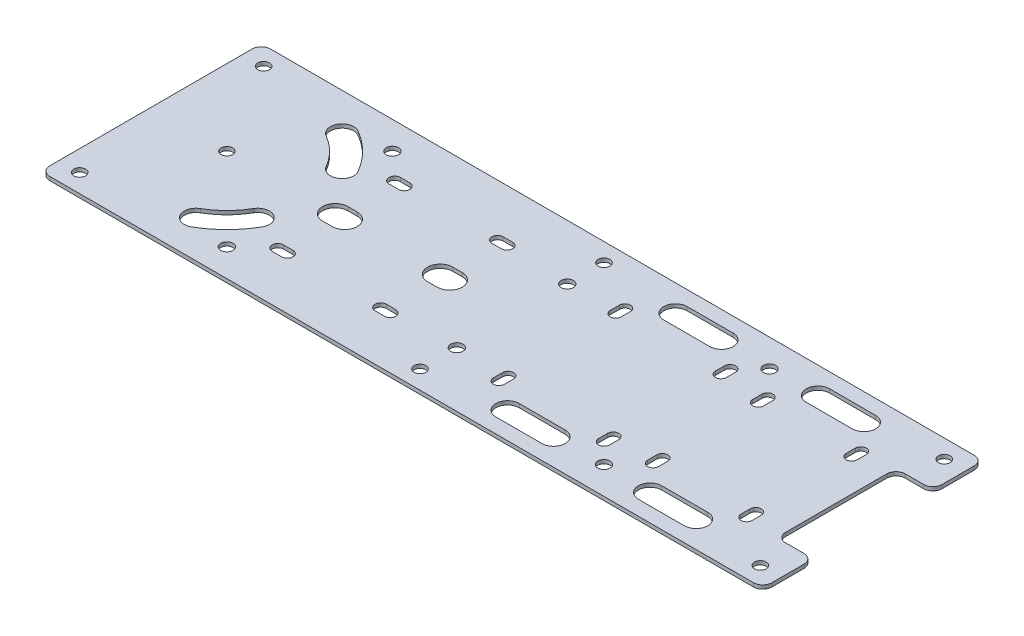
from build123d import *

# Parameters (mm, degrees)
SKETCH1_W               = 392.54
SKETCH1_H               = 120
SKETCH1_R               = 3.2
BOSS_EXTRUDE1_DEPTH     = 2.03
CUT_EXTRUDE3_DEPTH      = 206.246275971
CUT_EXTRUDE3_DEPTH_BACK = 206.246275971
SKETCH3_R               = 3.15
CUT_EXTRUDE4_DEPTH      = 206.246275971
FILLET1_R               = 5
SKETCH4_R               = 3.35
CUT_EXTRUDE5_DEPTH      = 206.246275971


with BuildPart() as part:
    # Sketch1 → Boss-Extrude1 (new body)
    with BuildSketch(Plane(origin=(0, 0, 0), x_dir=(1, 0, 0), z_dir=(0, 1, 0))):
        Rectangle(SKETCH1_W, SKETCH1_H)
        with Locations(Location((0, -50, 0), (0, 0, 270))):
            Circle(SKETCH1_R, mode=Mode.SUBTRACT)
        with Locations(Location((185, -50, 0), (0, 0, 270))):
            Circle(SKETCH1_R, mode=Mode.SUBTRACT)
        with Locations(Location((185, 50, 0), (0, 0, 270))):
            Circle(SKETCH1_R, mode=Mode.SUBTRACT)
        with Locations(Location((0, 50, 0), (0, 0, 270))):
            Circle(SKETCH1_R, mode=Mode.SUBTRACT)
        with Locations(Location((-185, 50, 0), (0, 0, 270))):
            Circle(SKETCH1_R, mode=Mode.SUBTRACT)
        with Locations(Location((-185, -50, 0), (0, 0, 270))):
            Circle(SKETCH1_R, mode=Mode.SUBTRACT)
    extrude(amount=BOSS_EXTRUDE1_DEPTH)

    # Sketch2 → Cut-Extrude3 (cut, two sides: drawn at the far end of the back side and taken through both)
    with BuildSketch(Plane(origin=(0, 0, 0), x_dir=(1, 0, 0), z_dir=(0, 1, 0)).offset(-CUT_EXTRUDE3_DEPTH_BACK)):
        with BuildLine():
            Line((181.27, -32.5), (196.27, -32.5))
            Line((196.27, -32.5), (196.27, 32.5))
            Line((196.27, 32.5), (181.27, 32.5))
            ThreePointArc((181.27, 32.5), (177.734466094, 31.035533906), (176.27, 27.5))
            Line((176.27, 27.5), (176.27, -27.5))
            ThreePointArc((176.27, -27.5), (177.734466094, -31.035533906), (181.27, -32.5))
        make_face()
    extrude(amount=CUT_EXTRUDE3_DEPTH + CUT_EXTRUDE3_DEPTH_BACK, mode=Mode.SUBTRACT)

    # Sketch3 → Cut-Extrude4 (cut, through all)
    with BuildSketch(Plane(origin=(0, 0, 0), x_dir=(1, 0, 0), z_dir=(0, 1, 0))):
        with Locations(Location((-155, 0, 0), (0, 0, 270))):
            Circle(SKETCH3_R)
        with BuildLine():
            Line((-90.375, 34.83), (-95.535, 34.83))
            ThreePointArc((-95.535, 34.83), (-98.615, 31.75), (-95.535, 28.67))
            Line((-95.535, 28.67), (-90.375, 28.67))
            ThreePointArc((-90.375, 28.67), (-87.295, 31.75), (-90.375, 34.83))
        make_face()
        with BuildLine():
            Line((-39.625, 28.67), (-34.465, 28.67))
            ThreePointArc((-34.465, 28.67), (-31.385, 31.75), (-34.465, 34.83))
            Line((-34.465, 34.83), (-39.625, 34.83))
            ThreePointArc((-39.625, 34.83), (-42.705, 31.75), (-39.625, 28.67))
        make_face()
        with BuildLine():
            Line((-95.535, -34.83), (-90.375, -34.83))
            ThreePointArc((-90.375, -34.83), (-87.295, -31.75), (-90.375, -28.67))
            Line((-90.375, -28.67), (-95.535, -28.67))
            ThreePointArc((-95.535, -28.67), (-98.615, -31.75), (-95.535, -34.83))
        make_face()
        with BuildLine():
            Line((-39.625, -34.83), (-34.465, -34.83))
            ThreePointArc((-34.465, -34.83), (-31.385, -31.75), (-34.465, -28.67))
            Line((-34.465, -28.67), (-39.625, -28.67))
            ThreePointArc((-39.625, -28.67), (-42.705, -31.75), (-39.625, -34.83))
        make_face()
        with BuildLine():
            Line((24.14375, 29.25), (24.14375, 34.25))
            ThreePointArc((24.14375, 34.25), (27.14375, 37.25), (30.14375, 34.25))
            Line((30.14375, 34.25), (30.14375, 29.25))
            ThreePointArc((30.14375, 29.25), (27.14375, 26.25), (24.14375, 29.25))
        make_face()
        with BuildLine():
            Line((81.29375, 29.25), (81.29375, 34.25))
            ThreePointArc((81.29375, 34.25), (84.29375, 37.25), (87.29375, 34.25))
            Line((87.29375, 34.25), (87.29375, 29.25))
            ThreePointArc((87.29375, 29.25), (84.29375, 26.25), (81.29375, 29.25))
        make_face()
        with BuildLine():
            Line((24.14375, -34.25), (24.14375, -29.25))
            ThreePointArc((24.14375, -29.25), (27.14375, -26.25), (30.14375, -29.25))
            Line((30.14375, -29.25), (30.14375, -34.25))
            ThreePointArc((30.14375, -34.25), (27.14375, -37.25), (24.14375, -34.25))
        make_face()
        with BuildLine():
            Line((81.29375, -34.25), (81.29375, -29.25))
            ThreePointArc((81.29375, -29.25), (84.29375, -26.25), (87.29375, -29.25))
            Line((87.29375, -29.25), (87.29375, -34.25))
            ThreePointArc((87.29375, -34.25), (84.29375, -37.25), (81.29375, -34.25))
        make_face()
        with BuildLine():
            Line((104.7875, 26.075), (104.7875, 31.075))
            ThreePointArc((104.7875, 31.075), (107.7875, 34.075), (110.7875, 31.075))
            Line((110.7875, 31.075), (110.7875, 26.075))
            ThreePointArc((110.7875, 26.075), (107.7875, 23.075), (104.7875, 26.075))
        make_face()
        with BuildLine():
            Line((155.5875, 26.075), (155.5875, 31.075))
            ThreePointArc((155.5875, 31.075), (158.5875, 34.075), (161.5875, 31.075))
            Line((161.5875, 31.075), (161.5875, 26.075))
            ThreePointArc((161.5875, 26.075), (158.5875, 23.075), (155.5875, 26.075))
        make_face()
        with BuildLine():
            Line((104.7875, -31.075), (104.7875, -26.075))
            ThreePointArc((104.7875, -26.075), (107.7875, -23.075), (110.7875, -26.075))
            Line((110.7875, -26.075), (110.7875, -31.075))
            ThreePointArc((110.7875, -31.075), (107.7875, -34.075), (104.7875, -31.075))
        make_face()
        with BuildLine():
            Line((155.5875, -31.075), (155.5875, -26.075))
            ThreePointArc((155.5875, -26.075), (158.5875, -23.075), (161.5875, -26.075))
            Line((161.5875, -26.075), (161.5875, -31.075))
            ThreePointArc((161.5875, -31.075), (158.5875, -34.075), (155.5875, -31.075))
        make_face()
        with BuildLine():
            Line((120.6875, 51.9875), (145.6875, 51.9875))
            ThreePointArc((145.6875, 51.9875), (152.0375, 45.6375), (145.6875, 39.2875))
            Line((145.6875, 39.2875), (120.6875, 39.2875))
            ThreePointArc((120.6875, 39.2875), (114.3375, 45.6375), (120.6875, 51.9875))
        make_face()
        with BuildLine():
            Line((120.6875, -39.2875), (145.6875, -39.2875))
            ThreePointArc((145.6875, -39.2875), (152.0375, -45.6375), (145.6875, -51.9875))
            Line((145.6875, -51.9875), (120.6875, -51.9875))
            ThreePointArc((120.6875, -51.9875), (114.3375, -45.6375), (120.6875, -39.2875))
        make_face()
        with BuildLine():
            Line((43.21875, -39.2875), (68.21875, -39.2875))
            ThreePointArc((68.21875, -39.2875), (74.56875, -45.6375), (68.21875, -51.9875))
            Line((68.21875, -51.9875), (43.21875, -51.9875))
            ThreePointArc((43.21875, -51.9875), (36.86875, -45.6375), (43.21875, -39.2875))
        make_face()
        with BuildLine():
            Line((43.21875, 51.9875), (68.21875, 51.9875))
            ThreePointArc((68.21875, 51.9875), (74.56875, 45.6375), (68.21875, 39.2875))
            Line((68.21875, 39.2875), (43.21875, 39.2875))
            ThreePointArc((43.21875, 39.2875), (36.86875, 45.6375), (43.21875, 51.9875))
        make_face()
        with BuildLine():
            Line((-96.105, 6.85), (-90.945, 6.85))
            ThreePointArc((-90.945, 6.85), (-84.095, 0), (-90.945, -6.85))
            Line((-90.945, -6.85), (-96.105, -6.85))
            ThreePointArc((-96.105, -6.85), (-102.955, 0), (-96.105, 6.85))
        make_face()
        with BuildLine():
            Line((-33.895, -6.85), (-39.055, -6.85))
            ThreePointArc((-39.055, -6.85), (-45.905, 0), (-39.055, 6.85))
            Line((-39.055, 6.85), (-33.895, 6.85))
            ThreePointArc((-33.895, 6.85), (-27.045, 0), (-33.895, -6.85))
        make_face()
        with BuildLine():
            ThreePointArc((-135.25, -34.208003449), (-127.069282143, -27.930717857), (-120.791996551, -19.75))
            ThreePointArc((-120.791996551, -19.75), (-112.117735236, -17.425738686), (-109.793473922, -26.1))
            ThreePointArc((-109.793473922, -26.1), (-118.089026022, -36.910973978), (-128.9, -45.206526078))
            ThreePointArc((-128.9, -45.206526078), (-137.574261314, -42.882264764), (-135.25, -34.208003449))
        make_face()
        with BuildLine():
            ThreePointArc((-128.9, 45.206526078), (-137.574261314, 42.882264764), (-135.25, 34.208003449))
            ThreePointArc((-135.25, 34.208003449), (-127.069282143, 27.930717857), (-120.791996551, 19.75))
            ThreePointArc((-120.791996551, 19.75), (-112.117735236, 17.425738686), (-109.793473922, 26.1))
            ThreePointArc((-109.793473922, 26.1), (-118.089026022, 36.910973978), (-128.9, 45.206526078))
        make_face()
    extrude(amount=CUT_EXTRUDE4_DEPTH, mode=Mode.SUBTRACT)

    # Fillet1
    fillet1_edges = [part.edges().sort_by_distance(p)[0] for p in [
        (196.27, 1.015, -32.5),
        (196.27, 1.015, 32.5),
        (196.27, 1.015, 60),
        (-196.27, 1.015, 60),
        (-196.27, 1.015, -60),
        (196.27, 1.015, -60),
    ]]
    fillet(fillet1_edges, radius=FILLET1_R)

    # Sketch4 → Cut-Extrude5 (cut, through all)
    with BuildSketch(Plane(origin=(0, 2.03, 0), x_dir=(1, 0, 0), z_dir=(0, 1, 0))):
        with Locations(Location((-110, 45, 0), (0, 0, 270))):
            Circle(SKETCH4_R)
        with Locations(Location((0, 30, 0), (0, 0, 270))):
            Circle(SKETCH4_R)
        with Locations(Location((95, 45, 0), (0, 0, 270))):
            Circle(SKETCH4_R)
        with Locations(Location((95, -45, 0), (0, 0, 90))):
            Circle(SKETCH4_R)
        with Locations(Location((0, -30, 0), (0, 0, 90))):
            Circle(SKETCH4_R)
        with Locations(Location((-110, -45, 0), (0, 0, 90))):
            Circle(SKETCH4_R)
    extrude(amount=-CUT_EXTRUDE5_DEPTH, mode=Mode.SUBTRACT)


solid = part.part
